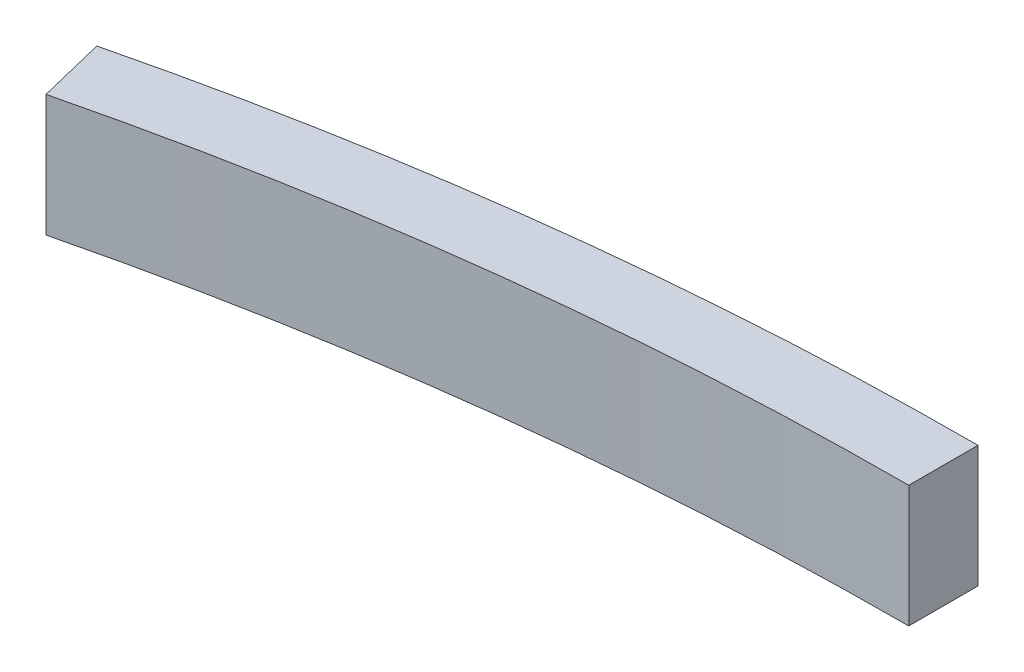
from build123d import *

# Parameters (mm, degrees)
BOSS_EXTRUDE1_DEPTH = 2.794


with BuildPart() as part:
    # Sketch1 → Boss-Extrude1 (new body)
    with BuildSketch(Plane(origin=(0, 0, 0), x_dir=(1, 0, 0), z_dir=(0, 1, 0))):
        with BuildLine():
            Line((-18.0295172, 73.657200832), (-17.652077968, 72.115222922))
            ThreePointArc((-17.652077968, 72.115222922), (-8.89, 73.710034145), (0, 74.2442))
            Line((0, 74.2442), (0, 75.8317))
            ThreePointArc((0, 75.8317), (-9.080087239, 75.286112535), (-18.0295172, 73.657200832))
        make_face()
    extrude(amount=BOSS_EXTRUDE1_DEPTH)


solid = part.part
